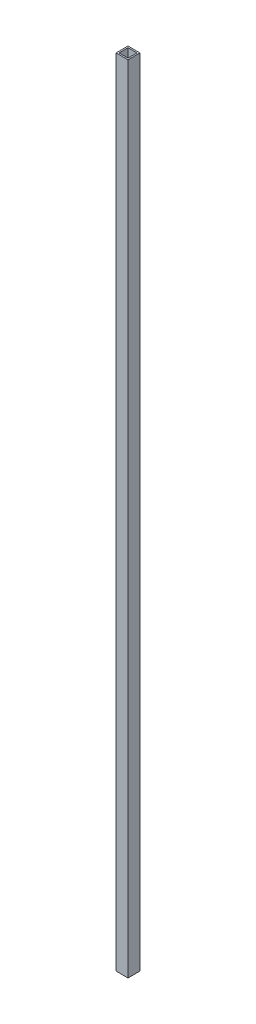
from build123d import *

# Parameters (mm, degrees)
SKETCH1_W           = 12.7
SKETCH1_H           = 12.7
SKETCH1_W_2         = 9.525
SKETCH1_H_2         = 9.525
BOSS_EXTRUDE1_DEPTH = 845


with BuildPart() as part:
    # Sketch1 → Boss-Extrude1 (new body)
    with BuildSketch(Plane(origin=(0, 0, 0), x_dir=(1, 0, 0), z_dir=(0, 1, 0))):
        Rectangle(SKETCH1_W, SKETCH1_H)
        Rectangle(SKETCH1_W_2, SKETCH1_H_2, mode=Mode.SUBTRACT)
    extrude(amount=BOSS_EXTRUDE1_DEPTH)


solid = part.part
